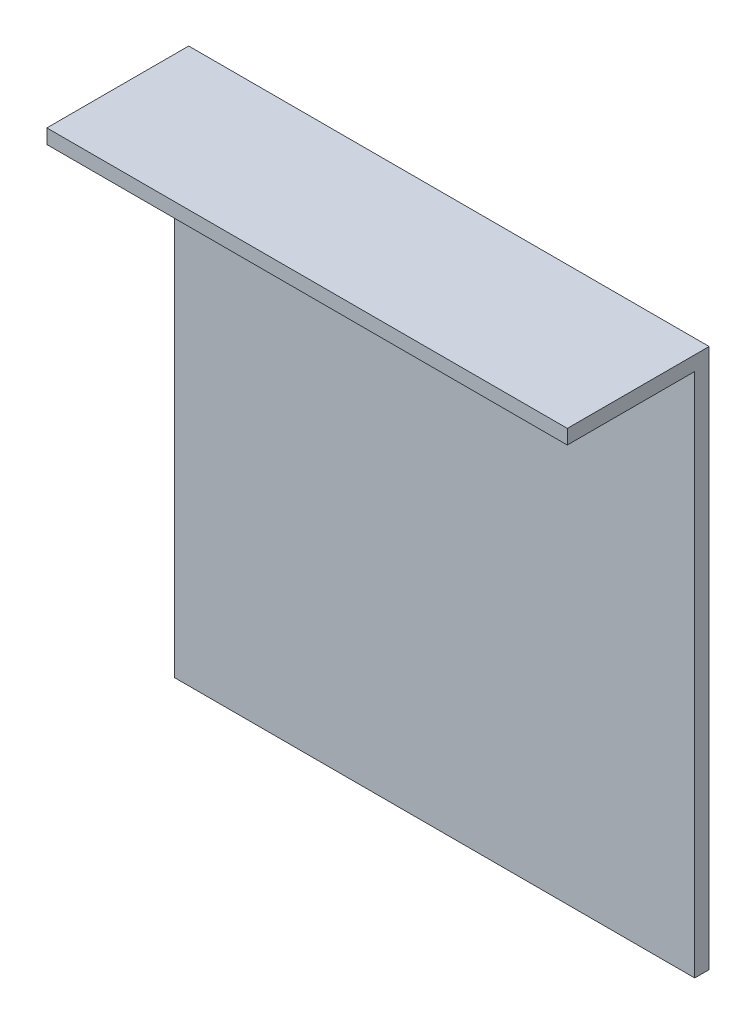
from build123d import *

# Parameters (mm, degrees)
SKETCH1_W           = 433
SKETCH1_H           = 449
BOSS_EXTRUDE1_DEPTH = 12
SKETCH2_W           = 433
SKETCH2_H           = 12
BOSS_EXTRUDE2_DEPTH = 106


with BuildPart() as part:
    # Sketch1 → Boss-Extrude1 (new body)
    with BuildSketch(Plane.XY):
        with Locations((0, -5.5)):
            Rectangle(SKETCH1_W, SKETCH1_H)
    extrude(amount=BOSS_EXTRUDE1_DEPTH)

    # Sketch2 → Boss-Extrude2 (add)
    with BuildSketch(Plane.XY.offset(12)):
        with Locations((0, 213)):
            Rectangle(SKETCH2_W, SKETCH2_H)
    extrude(amount=BOSS_EXTRUDE2_DEPTH)


solid = part.part
